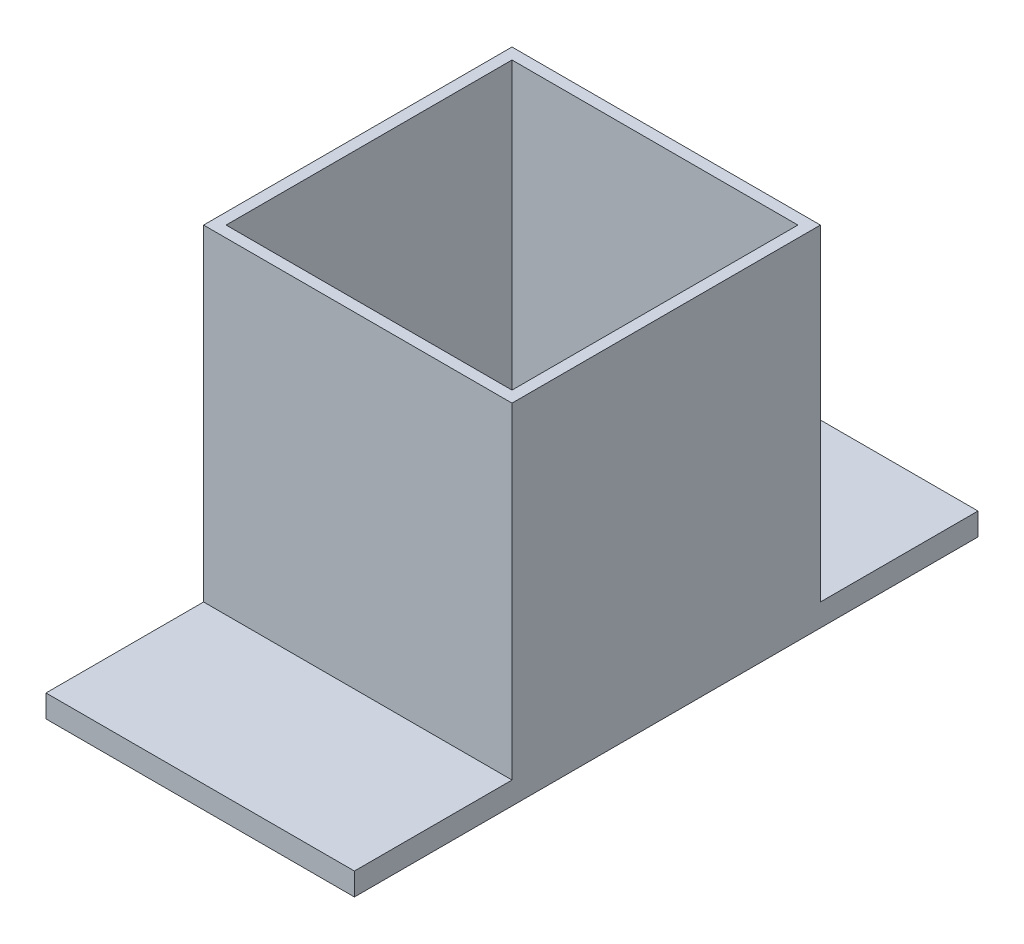
from build123d import *

# Parameters (mm, degrees)
SKETCH2_W           = 13.7
SKETCH2_H           = 13.7
BOSS_EXTRUDE2_DEPTH = 0.5
SKETCH2_4_W         = 13.7
SKETCH2_4_H         = 13.7
SKETCH2_4_W_2       = 12.7
SKETCH2_4_H_2       = 12.7
BOSS_EXTRUDE3_DEPTH = 15
SKETCH3_W           = 13.7
SKETCH3_H           = 1
BOSS_EXTRUDE4_DEPTH = 7
SKETCH4_W           = 13.7
SKETCH4_H           = 1
BOSS_EXTRUDE6_DEPTH = 7


with BuildPart() as part:
    # Sketch2 → Boss-Extrude2 (new body)
    with BuildSketch(Plane(origin=(0, 0, 0), x_dir=(1, 0, 0), z_dir=(0, 1, 0))):
        with Locations((6.85, 6.85)):
            Rectangle(SKETCH2_W, SKETCH2_H)
    extrude(amount=-BOSS_EXTRUDE2_DEPTH)

    # Sketch2<4> → Boss-Extrude3 (add)
    with BuildSketch(Plane(origin=(0, 0, 0), x_dir=(1, 0, 0), z_dir=(0, 1, 0))):
        with Locations((6.85, 6.85)):
            Rectangle(SKETCH2_4_W, SKETCH2_4_H)
        with Locations((6.85, 6.85)):
            Rectangle(SKETCH2_4_W_2, SKETCH2_4_H_2, mode=Mode.SUBTRACT)
    extrude(amount=BOSS_EXTRUDE3_DEPTH)

    # Sketch3 → Boss-Extrude4 (add)
    with BuildSketch(Plane.XY):
        with Locations((6.85, 0)):
            Rectangle(SKETCH3_W, SKETCH3_H)
    extrude(amount=BOSS_EXTRUDE4_DEPTH)

    # Sketch4 → Boss-Extrude6 (add)
    with BuildSketch(Plane(origin=(0, 0, -13.7), x_dir=(-1, 0, 0), z_dir=(0, 0, -1))):
        with Locations((-6.85, 0)):
            Rectangle(SKETCH4_W, SKETCH4_H)
    extrude(amount=BOSS_EXTRUDE6_DEPTH)


solid = part.part
